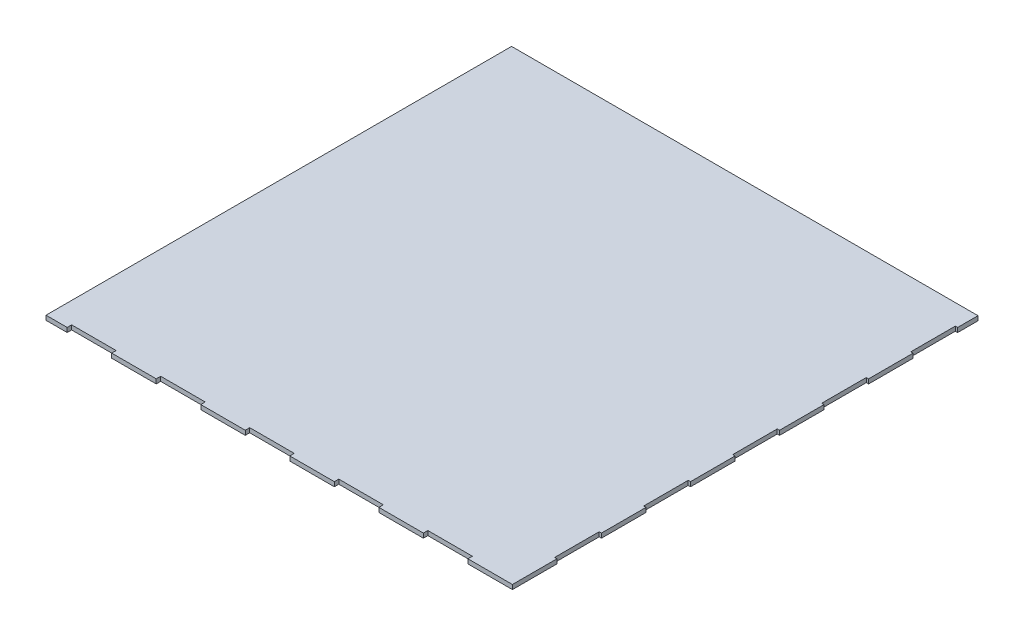
from build123d import *

# Parameters (mm, degrees)
SKETCH1_W               = 630
SKETCH1_H               = 630
BOSS_EXTRUDE1_DEPTH     = 3
SKETCH3_W               = 3
SKETCH3_H               = 30
CUT_EXTRUDE2_DEPTH      = 3
LPATTERN2_COUNT         = 10
LPATTERN2_PITCH         = 60
MIRROR1_COPY_1_SKETCH_W = 3
MIRROR1_COPY_1_SKETCH_H = 30
MIRROR1_COPY_1_DEPTH    = 3
MIRROR1_COPY_2_SKETCH_W = 3
MIRROR1_COPY_2_SKETCH_H = 30
MIRROR1_COPY_2_DEPTH    = 3
MIRROR1_COPY_3_SKETCH_W = 3
MIRROR1_COPY_3_SKETCH_H = 30
MIRROR1_COPY_3_DEPTH    = 3
MIRROR1_COPY_4_SKETCH_W = 3
MIRROR1_COPY_4_SKETCH_H = 30
MIRROR1_COPY_4_DEPTH    = 3
MIRROR1_COPY_5_SKETCH_W = 3
MIRROR1_COPY_5_SKETCH_H = 30
MIRROR1_COPY_5_DEPTH    = 3
MIRROR1_COPY_6_SKETCH_W = 3
MIRROR1_COPY_6_SKETCH_H = 30
MIRROR1_COPY_6_DEPTH    = 3
MIRROR1_COPY_7_SKETCH_W = 3
MIRROR1_COPY_7_SKETCH_H = 30
MIRROR1_COPY_7_DEPTH    = 3
MIRROR1_COPY_8_SKETCH_W = 3
MIRROR1_COPY_8_SKETCH_H = 30
MIRROR1_COPY_8_DEPTH    = 3
MIRROR1_COPY_9_SKETCH_W = 3
MIRROR1_COPY_9_SKETCH_H = 30
MIRROR1_COPY_9_DEPTH    = 3
SKETCH5_W               = 30
SKETCH5_H               = 3
CUT_EXTRUDE3_DEPTH      = 3
LPATTERN3_COUNT         = 10
LPATTERN3_PITCH         = 60
MIRROR2_COPY_1_SKETCH_W = 30
MIRROR2_COPY_1_SKETCH_H = 3
MIRROR2_COPY_1_DEPTH    = 3
MIRROR2_COPY_2_SKETCH_W = 30
MIRROR2_COPY_2_SKETCH_H = 3
MIRROR2_COPY_2_DEPTH    = 3
MIRROR2_COPY_3_SKETCH_W = 30
MIRROR2_COPY_3_SKETCH_H = 3
MIRROR2_COPY_3_DEPTH    = 3
MIRROR2_COPY_4_SKETCH_W = 30
MIRROR2_COPY_4_SKETCH_H = 3
MIRROR2_COPY_4_DEPTH    = 3
MIRROR2_COPY_5_SKETCH_W = 30
MIRROR2_COPY_5_SKETCH_H = 3
MIRROR2_COPY_5_DEPTH    = 3
MIRROR2_COPY_6_SKETCH_W = 30
MIRROR2_COPY_6_SKETCH_H = 3
MIRROR2_COPY_6_DEPTH    = 3
MIRROR2_COPY_7_SKETCH_W = 30
MIRROR2_COPY_7_SKETCH_H = 3
MIRROR2_COPY_7_DEPTH    = 3
MIRROR2_COPY_8_SKETCH_W = 30
MIRROR2_COPY_8_SKETCH_H = 3
MIRROR2_COPY_8_DEPTH    = 3
MIRROR2_COPY_9_SKETCH_W = 30
MIRROR2_COPY_9_SKETCH_H = 3
MIRROR2_COPY_9_DEPTH    = 3


with BuildPart() as part:
    # Sketch1 → Boss-Extrude1 (new body)
    with BuildSketch(Plane(origin=(0, 0, 0), x_dir=(1, 0, 0), z_dir=(0, 1, 0))):
        Rectangle(SKETCH1_W, SKETCH1_H)
    extrude(amount=BOSS_EXTRUDE1_DEPTH)

    # Sketch3 → Cut-Extrude2 (cut)
    with BuildSketch(Plane(origin=(0, 3, 0), x_dir=(1, 0, 0), z_dir=(0, 1, 0))):
        with Locations((-313.5, -270.006843512)):
            Rectangle(SKETCH3_W, SKETCH3_H)
    cut_extrude2 = extrude(amount=-CUT_EXTRUDE2_DEPTH, mode=Mode.SUBTRACT)

    # LPattern2: Cut-Extrude2 ×10
    with Locations(*[(0, 0, -i * LPATTERN2_PITCH) for i in range(1, LPATTERN2_COUNT)]):
        add(cut_extrude2, mode=Mode.SUBTRACT)

    # Mirror1: Cut-Extrude2 across plane
    add(cut_extrude2.mirror(Plane(origin=(0.72, 0, 0), x_dir=(0, 0, 1), z_dir=(1, 0, 0))), mode=Mode.SUBTRACT)

    # Mirror1 copy 1 sketch → Mirror1 copy 1 (cut)
    with BuildSketch(Plane(origin=(1.44, 3, -60), x_dir=(-1, 0, 0), z_dir=(0, 1, 0))):
        with Locations((-313.5, 270.006843512)):
            Rectangle(MIRROR1_COPY_1_SKETCH_W, MIRROR1_COPY_1_SKETCH_H)
    extrude(amount=-MIRROR1_COPY_1_DEPTH, mode=Mode.SUBTRACT)

    # Mirror1 copy 2 sketch → Mirror1 copy 2 (cut)
    with BuildSketch(Plane(origin=(1.44, 3, -120), x_dir=(-1, 0, 0), z_dir=(0, 1, 0))):
        with Locations((-313.5, 270.006843512)):
            Rectangle(MIRROR1_COPY_2_SKETCH_W, MIRROR1_COPY_2_SKETCH_H)
    extrude(amount=-MIRROR1_COPY_2_DEPTH, mode=Mode.SUBTRACT)

    # Mirror1 copy 3 sketch → Mirror1 copy 3 (cut)
    with BuildSketch(Plane(origin=(1.44, 3, -180), x_dir=(-1, 0, 0), z_dir=(0, 1, 0))):
        with Locations((-313.5, 270.006843512)):
            Rectangle(MIRROR1_COPY_3_SKETCH_W, MIRROR1_COPY_3_SKETCH_H)
    extrude(amount=-MIRROR1_COPY_3_DEPTH, mode=Mode.SUBTRACT)

    # Mirror1 copy 4 sketch → Mirror1 copy 4 (cut)
    with BuildSketch(Plane(origin=(1.44, 3, -240), x_dir=(-1, 0, 0), z_dir=(0, 1, 0))):
        with Locations((-313.5, 270.006843512)):
            Rectangle(MIRROR1_COPY_4_SKETCH_W, MIRROR1_COPY_4_SKETCH_H)
    extrude(amount=-MIRROR1_COPY_4_DEPTH, mode=Mode.SUBTRACT)

    # Mirror1 copy 5 sketch → Mirror1 copy 5 (cut)
    with BuildSketch(Plane(origin=(1.44, 3, -300), x_dir=(-1, 0, 0), z_dir=(0, 1, 0))):
        with Locations((-313.5, 270.006843512)):
            Rectangle(MIRROR1_COPY_5_SKETCH_W, MIRROR1_COPY_5_SKETCH_H)
    extrude(amount=-MIRROR1_COPY_5_DEPTH, mode=Mode.SUBTRACT)

    # Mirror1 copy 6 sketch → Mirror1 copy 6 (cut)
    with BuildSketch(Plane(origin=(1.44, 3, -360), x_dir=(-1, 0, 0), z_dir=(0, 1, 0))):
        with Locations((-313.5, 270.006843512)):
            Rectangle(MIRROR1_COPY_6_SKETCH_W, MIRROR1_COPY_6_SKETCH_H)
    extrude(amount=-MIRROR1_COPY_6_DEPTH, mode=Mode.SUBTRACT)

    # Mirror1 copy 7 sketch → Mirror1 copy 7 (cut)
    with BuildSketch(Plane(origin=(1.44, 3, -420), x_dir=(-1, 0, 0), z_dir=(0, 1, 0))):
        with Locations((-313.5, 270.006843512)):
            Rectangle(MIRROR1_COPY_7_SKETCH_W, MIRROR1_COPY_7_SKETCH_H)
    extrude(amount=-MIRROR1_COPY_7_DEPTH, mode=Mode.SUBTRACT)

    # Mirror1 copy 8 sketch → Mirror1 copy 8 (cut)
    with BuildSketch(Plane(origin=(1.44, 3, -480), x_dir=(-1, 0, 0), z_dir=(0, 1, 0))):
        with Locations((-313.5, 270.006843512)):
            Rectangle(MIRROR1_COPY_8_SKETCH_W, MIRROR1_COPY_8_SKETCH_H)
    extrude(amount=-MIRROR1_COPY_8_DEPTH, mode=Mode.SUBTRACT)

    # Mirror1 copy 9 sketch → Mirror1 copy 9 (cut)
    with BuildSketch(Plane(origin=(1.44, 3, -540), x_dir=(-1, 0, 0), z_dir=(0, 1, 0))):
        with Locations((-313.5, 270.006843512)):
            Rectangle(MIRROR1_COPY_9_SKETCH_W, MIRROR1_COPY_9_SKETCH_H)
    extrude(amount=-MIRROR1_COPY_9_DEPTH, mode=Mode.SUBTRACT)

    # Sketch5 → Cut-Extrude3 (cut)
    with BuildSketch(Plane(origin=(0, 3, 0), x_dir=(1, 0, 0), z_dir=(0, 1, 0))):
        with Locations((-270.000314512, -313.5)):
            Rectangle(SKETCH5_W, SKETCH5_H)
    cut_extrude3 = extrude(amount=-CUT_EXTRUDE3_DEPTH, mode=Mode.SUBTRACT)

    # LPattern3: Cut-Extrude3 ×10
    with Locations(*[(i * LPATTERN3_PITCH, 0, 0) for i in range(1, LPATTERN3_COUNT)]):
        add(cut_extrude3, mode=Mode.SUBTRACT)

    # Mirror2: Cut-Extrude3 across plane
    add(cut_extrude3.mirror(Plane.XY.offset(1.295)), mode=Mode.SUBTRACT)

    # Mirror2 copy 1 sketch → Mirror2 copy 1 (cut)
    with BuildSketch(Plane(origin=(60, 3, 2.59), x_dir=(1, 0, 0), z_dir=(0, 1, 0))):
        with Locations((-270.000314512, 313.5)):
            Rectangle(MIRROR2_COPY_1_SKETCH_W, MIRROR2_COPY_1_SKETCH_H)
    extrude(amount=-MIRROR2_COPY_1_DEPTH, mode=Mode.SUBTRACT)

    # Mirror2 copy 2 sketch → Mirror2 copy 2 (cut)
    with BuildSketch(Plane(origin=(120, 3, 2.59), x_dir=(1, 0, 0), z_dir=(0, 1, 0))):
        with Locations((-270.000314512, 313.5)):
            Rectangle(MIRROR2_COPY_2_SKETCH_W, MIRROR2_COPY_2_SKETCH_H)
    extrude(amount=-MIRROR2_COPY_2_DEPTH, mode=Mode.SUBTRACT)

    # Mirror2 copy 3 sketch → Mirror2 copy 3 (cut)
    with BuildSketch(Plane(origin=(180, 3, 2.59), x_dir=(1, 0, 0), z_dir=(0, 1, 0))):
        with Locations((-270.000314512, 313.5)):
            Rectangle(MIRROR2_COPY_3_SKETCH_W, MIRROR2_COPY_3_SKETCH_H)
    extrude(amount=-MIRROR2_COPY_3_DEPTH, mode=Mode.SUBTRACT)

    # Mirror2 copy 4 sketch → Mirror2 copy 4 (cut)
    with BuildSketch(Plane(origin=(240, 3, 2.59), x_dir=(1, 0, 0), z_dir=(0, 1, 0))):
        with Locations((-270.000314512, 313.5)):
            Rectangle(MIRROR2_COPY_4_SKETCH_W, MIRROR2_COPY_4_SKETCH_H)
    extrude(amount=-MIRROR2_COPY_4_DEPTH, mode=Mode.SUBTRACT)

    # Mirror2 copy 5 sketch → Mirror2 copy 5 (cut)
    with BuildSketch(Plane(origin=(300, 3, 2.59), x_dir=(1, 0, 0), z_dir=(0, 1, 0))):
        with Locations((-270.000314512, 313.5)):
            Rectangle(MIRROR2_COPY_5_SKETCH_W, MIRROR2_COPY_5_SKETCH_H)
    extrude(amount=-MIRROR2_COPY_5_DEPTH, mode=Mode.SUBTRACT)

    # Mirror2 copy 6 sketch → Mirror2 copy 6 (cut)
    with BuildSketch(Plane(origin=(360, 3, 2.59), x_dir=(1, 0, 0), z_dir=(0, 1, 0))):
        with Locations((-270.000314512, 313.5)):
            Rectangle(MIRROR2_COPY_6_SKETCH_W, MIRROR2_COPY_6_SKETCH_H)
    extrude(amount=-MIRROR2_COPY_6_DEPTH, mode=Mode.SUBTRACT)

    # Mirror2 copy 7 sketch → Mirror2 copy 7 (cut)
    with BuildSketch(Plane(origin=(420, 3, 2.59), x_dir=(1, 0, 0), z_dir=(0, 1, 0))):
        with Locations((-270.000314512, 313.5)):
            Rectangle(MIRROR2_COPY_7_SKETCH_W, MIRROR2_COPY_7_SKETCH_H)
    extrude(amount=-MIRROR2_COPY_7_DEPTH, mode=Mode.SUBTRACT)

    # Mirror2 copy 8 sketch → Mirror2 copy 8 (cut)
    with BuildSketch(Plane(origin=(480, 3, 2.59), x_dir=(1, 0, 0), z_dir=(0, 1, 0))):
        with Locations((-270.000314512, 313.5)):
            Rectangle(MIRROR2_COPY_8_SKETCH_W, MIRROR2_COPY_8_SKETCH_H)
    extrude(amount=-MIRROR2_COPY_8_DEPTH, mode=Mode.SUBTRACT)

    # Mirror2 copy 9 sketch → Mirror2 copy 9 (cut)
    with BuildSketch(Plane(origin=(540, 3, 2.59), x_dir=(1, 0, 0), z_dir=(0, 1, 0))):
        with Locations((-270.000314512, 313.5)):
            Rectangle(MIRROR2_COPY_9_SKETCH_W, MIRROR2_COPY_9_SKETCH_H)
    extrude(amount=-MIRROR2_COPY_9_DEPTH, mode=Mode.SUBTRACT)

    # SurfaceCut1
    split(bisect_by=Plane.XY.offset(1.295), keep=Keep.TOP)

    # SurfaceCut2
    split(bisect_by=Plane(origin=(0.72, 0, 0), x_dir=(0, 0, -1), z_dir=(1, 0, 0)), keep=Keep.TOP)


solid = part.part
